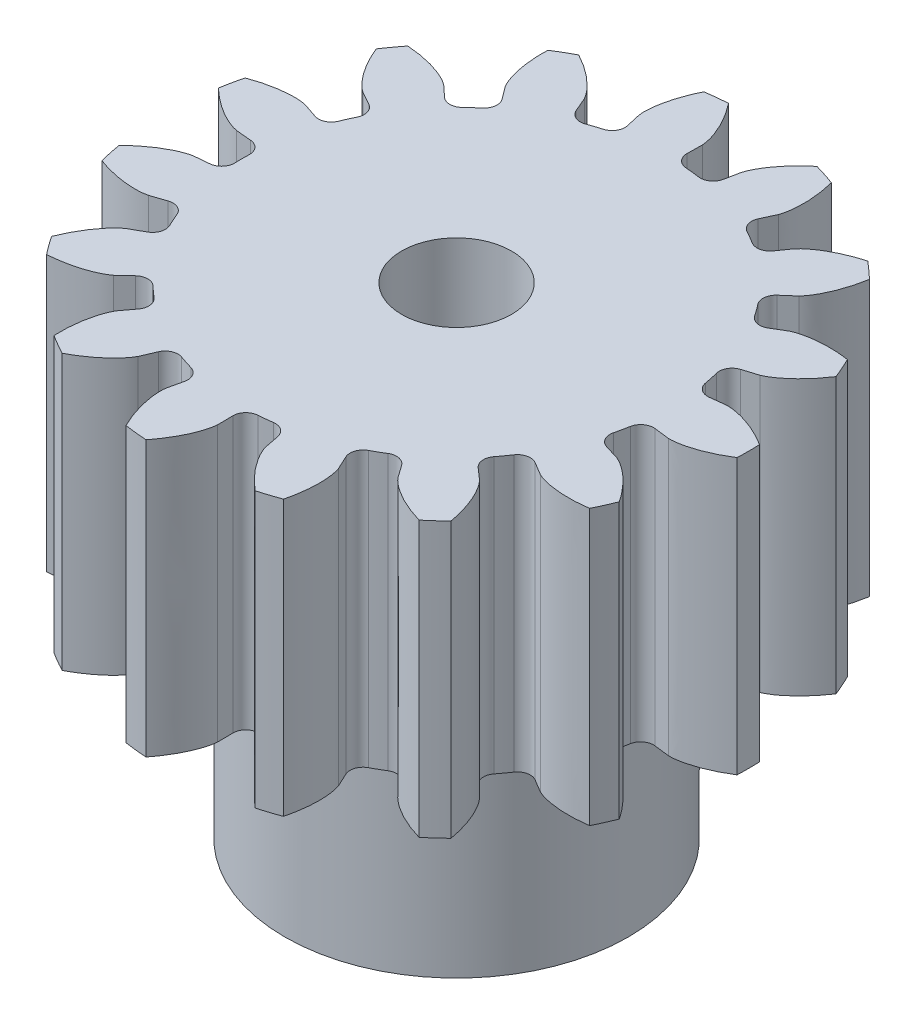
from build123d import *

# Parameters (mm, degrees)
BOSS_EXTRUDE1_DEPTH      = 4
BOSS_EXTRUDE1_DEPTH_BACK = 4
SKETCH2_R                = 5
BOSS_EXTRUDE2_DEPTH      = 6
CUT_EXTRUDE1_REACH       = 20.444
SKETCH3_R                = 1.6


with BuildPart() as part:
    # Sketch1 → Boss-Extrude1 (new, two sides: drawn at the far end of the back side and taken through both)
    with BuildSketch(Plane(origin=(0, 0, 8), x_dir=(1, 0, 0), z_dir=(0, -1, 0)).offset(-BOSS_EXTRUDE1_DEPTH_BACK)):
        with BuildLine():
            Line((6.567109026, -8.789353559), (7.013376588, -8.842263002))
            add(Edge.make_bspline(
                [(7.013376588, -8.842263002), (7.13650623, -8.846158953), (7.26014648, -8.826739675), (7.380662944, -8.801207947), (7.5493573, -8.765469607), (7.714728417, -8.712040157), (7.874555163, -8.647306658), (8.089914841, -8.560081048), (8.297207677, -8.451055972), (8.493631405, -8.3269358)],
                knots=[0, 0, 0, 0, 0.000369574, 0.000369574, 0.000369574, 0.000886684, 0.000886684, 0.000886684, 0.001584079, 0.001584079, 0.001584079, 0.001584079], degree=3))
            ThreePointArc((8.493631405, -8.3269358), (8.499921204, -8), (8.493631405, -7.6730642))
            add(Edge.make_bspline(
                [(8.493631405, -7.6730642), (8.306513905, -7.554824634), (8.109584884, -7.450333654), (7.905230151, -7.36528839), (7.765919668, -7.307312258), (7.622450842, -7.257991784), (7.476161462, -7.221004491), (7.40107364, -7.20201955), (7.325048593, -7.186231596), (7.248436403, -7.174865806), (7.170725894, -7.163337076), (7.091898317, -7.155252488), (7.013376588, -7.157736998)],
                knots=[0, 0, 0, 0, 0.000664035, 0.000664035, 0.000664035, 0.001116085, 0.001116085, 0.001116085, 0.001347695, 0.001347695, 0.001347695, 0.001582954, 0.001582954, 0.001582954, 0.001582954], degree=3))
            Line((7.013376588, -7.157736998), (6.567109026, -7.210646441))
            ThreePointArc((6.567109026, -7.210646441), (6.299401561, -7.139849418), (6.153266145, -6.90463899))
            ThreePointArc((6.153266145, -6.90463899), (6.113422505, -6.700551932), (6.066811797, -6.49790326))
            ThreePointArc((6.066811797, -6.49790326), (6.104644442, -6.223589213), (6.320411637, -6.050026478))
            Line((6.320411637, -6.050026478), (6.749617551, -5.91684829))
            add(Edge.make_bspline(
                [(6.749617551, -5.91684829), (6.863686702, -5.870326081), (6.968739159, -5.802296667), (7.068451738, -5.729953811), (7.208025608, -5.628691037), (7.337367925, -5.512618312), (7.457047437, -5.388473925), (7.618310441, -5.221194693), (7.763337377, -5.037281737), (7.892295159, -4.84399959)],
                knots=[0, 0, 0, 0, 0.000369574, 0.000369574, 0.000369574, 0.000886684, 0.000886684, 0.000886684, 0.001584079, 0.001584079, 0.001584079, 0.001584079], degree=3))
            ThreePointArc((7.892295159, -4.84399959), (7.765064406, -4.542770583), (7.626341619, -4.246658159))
            add(Edge.make_bspline(
                [(7.626341619, -4.246658159), (7.407308913, -4.214748485), (7.18490499, -4.199389474), (6.963626627, -4.204815317), (6.81277915, -4.208514164), (6.661653412, -4.221811698), (6.512967325, -4.247523375), (6.436649316, -4.260720737), (6.360775441, -4.277219896), (6.286163839, -4.297997716), (6.2104826, -4.319073408), (6.135181726, -4.343749833), (6.064459099, -4.37795721)],
                knots=[0, 0, 0, 0, 0.000664035, 0.000664035, 0.000664035, 0.001116085, 0.001116085, 0.001116085, 0.001347695, 0.001347695, 0.001347695, 0.001582954, 0.001582954, 0.001582954, 0.001582954], degree=3))
            Line((6.064459099, -4.37795721), (5.678293604, -4.607805762))
            ThreePointArc((5.678293604, -4.607805762), (5.404934922, -4.652015898), (5.175764877, -4.496579109))
            ThreePointArc((5.175764877, -4.496579109), (5.056356215, -4.326342173), (4.931350574, -4.160171681))
            ThreePointArc((4.931350574, -4.160171681), (4.854338841, -3.894185407), (4.980857657, -3.647867535))
            Line((4.980857657, -3.647867535), (5.318788321, -3.351629433))
            add(Edge.make_bspline(
                [(5.318788321, -3.351629433), (5.404073389, -3.262733177), (5.472373528, -3.157856531), (5.534041011, -3.051211284), (5.620360805, -2.90193333), (5.691309861, -2.743287359), (5.750148465, -2.581197774), (5.829430956, -2.362789019), (5.887115516, -2.135788405), (5.926309381, -1.906764522)],
                knots=[0, 0, 0, 0, 0.000369574, 0.000369574, 0.000369574, 0.000886684, 0.000886684, 0.000886684, 0.001584079, 0.001584079, 0.001584079, 0.001584079], degree=3))
            ThreePointArc((5.926309381, -1.906764522), (5.687557429, -1.68332754), (5.440388084, -1.469239021))
            add(Edge.make_bspline(
                [(5.440388084, -1.469239021), (5.227312916, -1.529176712), (5.01788975, -1.605605381), (4.817948796, -1.700564154), (4.681647225, -1.765298415), (4.548995588, -1.838914692), (4.42362197, -1.922879558), (4.35926985, -1.965977279), (4.296666428, -2.011910696), (4.236956439, -2.061239451), (4.176390443, -2.111275387), (4.117636479, -2.164446048), (4.066941537, -2.224461526)],
                knots=[0, 0, 0, 0, 0.000664035, 0.000664035, 0.000664035, 0.001116085, 0.001116085, 0.001116085, 0.001347695, 0.001347695, 0.001347695, 0.001582954, 0.001582954, 0.001582954, 0.001582954], degree=3))
            Line((4.066941537, -2.224461526), (3.807649632, -2.591506283))
            ThreePointArc((3.807649632, -2.591506283), (3.575905932, -2.743079246), (3.30332684, -2.694292527))
            ThreePointArc((3.30332684, -2.694292527), (3.125, -2.587341226), (2.943214036, -2.486381303))
            ThreePointArc((2.943214036, -2.486381303), (2.764673953, -2.274714244), (2.780068139, -1.998231832))
            Line((2.780068139, -1.998231832), (2.96829227, -1.590156076))
            add(Edge.make_bspline(
                [(2.96829227, -1.590156076), (3.010046692, -1.474256743), (3.029784799, -1.35066699), (3.042744319, -1.228159284), (3.06088456, -1.056677664), (3.061172619, -0.882889777), (3.048996584, -0.710881757), (3.0325899, -0.479108337), (2.992957899, -0.248270532), (2.935610871, -0.023105224)],
                knots=[0, 0, 0, 0, 0.000369574, 0.000369574, 0.000369574, 0.000886684, 0.000886684, 0.000886684, 0.001584079, 0.001584079, 0.001584079, 0.001584079], degree=3))
            ThreePointArc((2.935610871, -0.023105224), (2.626620103, 0.083905449), (2.313742025, 0.178952213))
            add(Edge.make_bspline(
                [(2.313742025, 0.178952213), (2.143467028, 0.03753093), (1.983235787, -0.117470209), (1.839203848, -0.285542678), (1.741015964, -0.400119211), (1.6497751, -0.521325308), (1.569392189, -0.649025074), (1.528133024, -0.714571167), (1.489624757, -0.781996537), (1.455140779, -0.851346838), (1.420162438, -0.92169135), (1.388114476, -0.994162555), (1.366212837, -1.069608913)],
                knots=[0, 0, 0, 0, 0.000664035, 0.000664035, 0.000664035, 0.001116085, 0.001116085, 0.001116085, 0.001347695, 0.001347695, 0.001347695, 0.001582954, 0.001582954, 0.001582954, 0.001582954], degree=3))
            Line((1.366212837, -1.069608913), (1.278628447, -1.510384503))
            ThreePointArc((1.278628447, -1.510384503), (1.128570321, -1.743111949), (0.859713583, -1.809410969))
            ThreePointArc((0.859713583, -1.809410969), (0.653302895, -1.784238154), (0.446169054, -1.765945687))
            ThreePointArc((0.446169054, -1.765945687), (0.196971823, -1.645197001), (0.098579583, -1.38635637))
            Line((0.098579583, -1.38635637), (0.10455152, -0.937002965))
            add(Edge.make_bspline(
                [(0.10455152, -0.937002965), (0.095555577, -0.814140602), (0.063318754, -0.693207534), (0.025329491, -0.576020064), (-0.027846432, -0.411985508), (-0.09826918, -0.253105209), (-0.179354506, -0.100920504), (-0.2886135, 0.104141852), (-0.418709328, 0.298902893), (-0.562681427, 0.4812765)],
                knots=[0, 0, 0, 0, 0.000369574, 0.000369574, 0.000369574, 0.000886684, 0.000886684, 0.000886684, 0.001584079, 0.001584079, 0.001584079, 0.001584079], degree=3))
            ThreePointArc((-0.562681427, 0.4812765), (-0.888483701, 0.453357746), (-1.21297105, 0.412928307))
            add(Edge.make_bspline(
                [(-1.21297105, 0.412928307), (-1.311003782, 0.214476455), (-1.394337662, 0.007703951), (-1.457556153, -0.204420956), (-1.500652775, -0.349028438), (-1.53470649, -0.49686672), (-1.556199759, -0.646220937), (-1.567231884, -0.722881886), (-1.574986569, -0.80014075), (-1.57828194, -0.8775213), (-1.581624555, -0.956011182), (-1.58142513, -1.035252003), (-1.570746474, -1.11308388)],
                knots=[0, 0, 0, 0, 0.000664035, 0.000664035, 0.000664035, 0.001116085, 0.001116085, 0.001116085, 0.001347695, 0.001347695, 0.001347695, 0.001582954, 0.001582954, 0.001582954, 0.001582954], degree=3))
            Line((-1.570746474, -1.11308388), (-1.471479212, -1.551376199))
            ThreePointArc((-1.471479212, -1.551376199), (-1.513905352, -1.825017438), (-1.732551962, -1.994938493))
            ThreePointArc((-1.732551962, -1.994938493), (-1.931356215, -2.055896773), (-2.128022611, -2.123434697))
            ThreePointArc((-2.128022611, -2.123434697), (-2.404788525, -2.114482928), (-2.599954278, -1.918039975))
            Line((-2.599954278, -1.918039975), (-2.777267138, -1.505106207))
            add(Edge.make_bspline(
                [(-2.777267138, -1.505106207), (-2.835457966, -1.396524834), (-2.914095679, -1.299158875), (-2.996465036, -1.20755442), (-3.111762524, -1.079329993), (-3.240719344, -0.962829129), (-3.376693572, -0.856781856), (-3.559913004, -0.713887709), (-3.757977909, -0.588879385), (-3.963680994, -0.480831533)],
                knots=[0, 0, 0, 0, 0.000369574, 0.000369574, 0.000369574, 0.000886684, 0.000886684, 0.000886684, 0.001584079, 0.001584079, 0.001584079, 0.001584079], degree=3))
            ThreePointArc((-3.963680994, -0.480831533), (-4.249960602, -0.638852307), (-4.529950411, -0.807767333))
            add(Edge.make_bspline(
                [(-4.529950411, -0.807767333), (-4.538790128, -1.028935625), (-4.530817461, -1.251726649), (-4.502291454, -1.471225671), (-4.482845015, -1.620860155), (-4.453823386, -1.76976804), (-4.412710631, -1.914952006), (-4.391608162, -1.989472438), (-4.367268408, -2.063206036), (-4.338805374, -2.135237034), (-4.309934294, -2.208300674), (-4.277521964, -2.280609652), (-4.236109451, -2.347369209)],
                knots=[0, 0, 0, 0, 0.000664035, 0.000664035, 0.000664035, 0.001116085, 0.001116085, 0.001116085, 0.001347695, 0.001347695, 0.001347695, 0.001582954, 0.001582954, 0.001582954, 0.001582954], degree=3))
            Line((-4.236109451, -2.347369209), (-3.967154748, -2.707393534))
            ThreePointArc((-3.967154748, -2.707393534), (-3.894613036, -2.974633511), (-4.025243534, -3.218795707))
            ThreePointArc((-4.025243534, -3.218795707), (-4.18206629, -3.355344841), (-4.334259835, -3.497035234))
            ThreePointArc((-4.334259835, -3.497035234), (-4.59073909, -3.601428225), (-4.848932425, -3.501349721))
            Line((-4.848932425, -3.501349721), (-5.178871077, -3.19623559))
            add(Edge.make_bspline(
                [(-5.178871077, -3.19623559), (-5.276195067, -3.120709912), (-5.387636496, -3.063746522), (-5.500143536, -3.013564324), (-5.657626606, -2.943321194), (-5.822819693, -2.889343824), (-5.990171643, -2.84777052), (-6.215671209, -2.791752278), (-6.447457969, -2.758111746), (-6.679324109, -2.743072103)],
                knots=[0, 0, 0, 0, 0.000369574, 0.000369574, 0.000369574, 0.000886684, 0.000886684, 0.000886684, 0.001584079, 0.001584079, 0.001584079, 0.001584079], degree=3))
            ThreePointArc((-6.679324109, -2.743072103), (-6.876580705, -3.003871671), (-7.063660193, -3.27206534))
            add(Edge.make_bspline(
                [(-7.063660193, -3.27206534), (-6.981778428, -3.477708065), (-6.883877761, -3.677995018), (-6.768539661, -3.86691478), (-6.689912627, -3.995703104), (-6.602833756, -4.119933065), (-6.506223747, -4.235843155), (-6.456635492, -4.295337809), (-6.404409863, -4.352796933), (-6.349109942, -4.407023566), (-6.293017238, -4.462027595), (-6.233996391, -4.514901852), (-6.169010619, -4.559045755)],
                knots=[0, 0, 0, 0, 0.000664035, 0.000664035, 0.000664035, 0.001116085, 0.001116085, 0.001116085, 0.001347695, 0.001347695, 0.001347695, 0.001582954, 0.001582954, 0.001582954, 0.001582954], degree=3))
            Line((-6.169010619, -4.559045755), (-5.776873187, -4.778550608))
            ThreePointArc((-5.776873187, -4.778550608), (-5.601906744, -4.993181103), (-5.62193393, -5.269366579))
            ThreePointArc((-5.62193393, -5.269366579), (-5.70965911, -5.457895981), (-5.791064157, -5.649239287))
            ThreePointArc((-5.791064157, -5.649239287), (-5.982909161, -5.848926542), (-6.259486104, -5.862516969))
            Line((-6.259486104, -5.862516969), (-6.685001158, -5.71797948))
            add(Edge.make_bspline(
                [(-6.685001158, -5.71797948), (-6.804630108, -5.688568573), (-6.929606017, -5.68185724), (-7.052797252, -5.681774257), (-7.225235649, -5.681658099), (-7.398101619, -5.6995374), (-7.567894618, -5.729626467), (-7.796683394, -5.770170193), (-8.022113973, -5.833714206), (-8.240051405, -5.914283265)],
                knots=[0, 0, 0, 0, 0.000369574, 0.000369574, 0.000369574, 0.000886684, 0.000886684, 0.000886684, 0.001584079, 0.001584079, 0.001584079, 0.001584079], degree=3))
            ThreePointArc((-8.240051405, -5.914283265), (-8.314177532, -6.232767011), (-8.375998955, -6.553866202))
            add(Edge.make_bspline(
                [(-8.375998955, -6.553866202), (-8.217553809, -6.708425865), (-8.046653057, -6.851577312), (-7.86444587, -6.977251872), (-7.74023357, -7.062925364), (-7.610154186, -7.140996913), (-7.47475167, -7.207591218), (-7.405251888, -7.241772929), (-7.334170672, -7.273022374), (-7.261595722, -7.300068364), (-7.187980332, -7.327502086), (-7.112556207, -7.351799182), (-7.035233808, -7.36569455)],
                knots=[0, 0, 0, 0, 0.000664035, 0.000664035, 0.000664035, 0.001116085, 0.001116085, 0.001116085, 0.001347695, 0.001347695, 0.001347695, 0.001582954, 0.001582954, 0.001582954, 0.001582954], degree=3))
            Line((-7.035233808, -7.36569455), (-6.587717771, -7.406725549))
            ThreePointArc((-6.587717771, -7.406725549), (-6.340579885, -7.531634999), (-6.246540877, -7.792088776))
            ThreePointArc((-6.246540877, -7.792088776), (-6.25, -8), (-6.246540877, -8.207911224))
            ThreePointArc((-6.246540877, -8.207911224), (-6.340579885, -8.468365001), (-6.587717771, -8.593274451))
            Line((-6.587717771, -8.593274451), (-7.035233808, -8.63430545))
            add(Edge.make_bspline(
                [(-7.035233808, -8.63430545), (-7.156482786, -8.656094727), (-7.273383704, -8.700795901), (-7.38595825, -8.750826481), (-7.54353581, -8.820857381), (-7.694184564, -8.907501859), (-7.837059861, -9.004050624), (-8.029578189, -9.134145939), (-8.209673592, -9.283887161), (-8.375998955, -9.446133798)],
                knots=[0, 0, 0, 0, 0.000369574, 0.000369574, 0.000369574, 0.000886684, 0.000886684, 0.000886684, 0.001584079, 0.001584079, 0.001584079, 0.001584079], degree=3))
            ThreePointArc((-8.375998955, -9.446133798), (-8.314177532, -9.767232989), (-8.240051405, -10.085716735))
            add(Edge.make_bspline(
                [(-8.240051405, -10.085716735), (-8.032439483, -10.162468567), (-7.818088938, -10.223732323), (-7.600517942, -10.264431406), (-7.452197811, -10.292176342), (-7.30160982, -10.310590199), (-7.150827123, -10.316353959), (-7.073432959, -10.319312397), (-6.995786742, -10.31894885), (-6.918485631, -10.3141377), (-6.840076326, -10.309257577), (-6.76129044, -10.300776323), (-6.685001158, -10.28202052)],
                knots=[0, 0, 0, 0, 0.000664035, 0.000664035, 0.000664035, 0.001116085, 0.001116085, 0.001116085, 0.001347695, 0.001347695, 0.001347695, 0.001582954, 0.001582954, 0.001582954, 0.001582954], degree=3))
            Line((-6.685001158, -10.28202052), (-6.259486104, -10.137483031))
            ThreePointArc((-6.259486104, -10.137483031), (-5.982909161, -10.151073458), (-5.791064157, -10.350760713))
            ThreePointArc((-5.791064157, -10.350760713), (-5.70965911, -10.542104019), (-5.62193393, -10.730633421))
            ThreePointArc((-5.62193393, -10.730633421), (-5.601906744, -11.006818897), (-5.776873187, -11.221449392))
            Line((-5.776873187, -11.221449392), (-6.169010619, -11.440954245))
            add(Edge.make_bspline(
                [(-6.169010619, -11.440954245), (-6.270914575, -11.510176142), (-6.359527273, -11.598560583), (-6.442019967, -11.690053985), (-6.557490098, -11.818122964), (-6.659873099, -11.958551002), (-6.751126257, -12.104865306), (-6.87408597, -12.302017549), (-6.977706065, -12.512064361), (-7.063660193, -12.72793466)],
                knots=[0, 0, 0, 0, 0.000369574, 0.000369574, 0.000369574, 0.000886684, 0.000886684, 0.000886684, 0.001584079, 0.001584079, 0.001584079, 0.001584079], degree=3))
            ThreePointArc((-7.063660193, -12.72793466), (-6.876580705, -12.996128329), (-6.679324109, -13.256927897))
            add(Edge.make_bspline(
                [(-6.679324109, -13.256927897), (-6.458443398, -13.242600808), (-6.237706217, -13.211383812), (-6.022391413, -13.160070178), (-5.875609349, -13.125089206), (-5.730550784, -13.080661448), (-5.590459603, -13.024598056), (-5.518553211, -12.995821682), (-5.44776773, -12.963908004), (-5.379106522, -12.928071605), (-5.309460983, -12.891721453), (-5.240936131, -12.851928335), (-5.178871077, -12.80376441)],
                knots=[0, 0, 0, 0, 0.000664035, 0.000664035, 0.000664035, 0.001116085, 0.001116085, 0.001116085, 0.001347695, 0.001347695, 0.001347695, 0.001582954, 0.001582954, 0.001582954, 0.001582954], degree=3))
            Line((-5.178871077, -12.80376441), (-4.848932425, -12.498650279))
            ThreePointArc((-4.848932425, -12.498650279), (-4.59073909, -12.398571775), (-4.334259835, -12.502964766))
            ThreePointArc((-4.334259835, -12.502964766), (-4.18206629, -12.644655159), (-4.025243534, -12.781204293))
            ThreePointArc((-4.025243534, -12.781204293), (-3.894613036, -13.025366489), (-3.967154748, -13.292606466))
            Line((-3.967154748, -13.292606466), (-4.236109451, -13.652630791))
            add(Edge.make_bspline(
                [(-4.236109451, -13.652630791), (-4.301048265, -13.757316213), (-4.346050801, -13.87410145), (-4.384197908, -13.991237633), (-4.437594776, -14.1552004), (-4.474009073, -14.325130714), (-4.497861591, -14.495911486), (-4.530001837, -14.726031242), (-4.539229769, -14.960064643), (-4.529950411, -15.192232667)],
                knots=[0, 0, 0, 0, 0.000369574, 0.000369574, 0.000369574, 0.000886684, 0.000886684, 0.000886684, 0.001584079, 0.001584079, 0.001584079, 0.001584079], degree=3))
            ThreePointArc((-4.529950411, -15.192232667), (-4.249960602, -15.361147693), (-3.963680994, -15.519168467))
            add(Edge.make_bspline(
                [(-3.963680994, -15.519168467), (-3.767723776, -15.416239741), (-3.578767423, -15.297939697), (-3.402938697, -15.163485939), (-3.283074653, -15.071827587), (-3.168627456, -14.972240176), (-3.06345083, -14.864043503), (-3.009465478, -14.808508013), (-2.957780186, -14.750562368), (-2.909631028, -14.689897159), (-2.860791601, -14.62836225), (-2.814376353, -14.56413786), (-2.777267138, -14.494893793)],
                knots=[0, 0, 0, 0, 0.000664035, 0.000664035, 0.000664035, 0.001116085, 0.001116085, 0.001116085, 0.001347695, 0.001347695, 0.001347695, 0.001582954, 0.001582954, 0.001582954, 0.001582954], degree=3))
            Line((-2.777267138, -14.494893793), (-2.599954278, -14.081960025))
            ThreePointArc((-2.599954278, -14.081960025), (-2.404788525, -13.885517072), (-2.128022611, -13.876565303))
            ThreePointArc((-2.128022611, -13.876565303), (-1.931356215, -13.944103227), (-1.732551962, -14.005061507))
            ThreePointArc((-1.732551962, -14.005061507), (-1.513905352, -14.174982562), (-1.471479212, -14.448623801))
            Line((-1.471479212, -14.448623801), (-1.570746474, -14.88691612))
            add(Edge.make_bspline(
                [(-1.570746474, -14.88691612), (-1.587491636, -15.008964007), (-1.581102663, -15.13395681), (-1.568308202, -15.256481865), (-1.550399002, -15.427987769), (-1.514548232, -15.598037864), (-1.466875795, -15.763755556), (-1.402639232, -15.98705303), (-1.315879408, -16.204606518), (-1.21297105, -16.412928307)],
                knots=[0, 0, 0, 0, 0.000369574, 0.000369574, 0.000369574, 0.000886684, 0.000886684, 0.000886684, 0.001584079, 0.001584079, 0.001584079, 0.001584079], degree=3))
            ThreePointArc((-1.21297105, -16.412928307), (-0.888483701, -16.453357746), (-0.562681427, -16.4812765))
            add(Edge.make_bspline(
                [(-0.562681427, -16.4812765), (-0.425530485, -16.307543449), (-0.30102723, -16.122615508), (-0.195086966, -15.928269903), (-0.122866523, -15.795782733), (-0.058819656, -15.658255237), (-0.006743578, -15.51663347), (0.019986176, -15.443941454), (0.043634423, -15.369983172), (0.062946104, -15.294978719), (0.082534638, -15.218898997), (0.098814664, -15.141348316), (0.10455152, -15.062997035)],
                knots=[0, 0, 0, 0, 0.000664035, 0.000664035, 0.000664035, 0.001116085, 0.001116085, 0.001116085, 0.001347695, 0.001347695, 0.001347695, 0.001582954, 0.001582954, 0.001582954, 0.001582954], degree=3))
            Line((0.10455152, -15.062997035), (0.098579583, -14.61364363))
            ThreePointArc((0.098579583, -14.61364363), (0.196971823, -14.354802999), (0.446169054, -14.234054313))
            ThreePointArc((0.446169054, -14.234054313), (0.653302895, -14.215761846), (0.859713583, -14.190589031))
            ThreePointArc((0.859713583, -14.190589031), (1.128570321, -14.256888051), (1.278628447, -14.489615497))
            Line((1.278628447, -14.489615497), (1.366212837, -14.930391087))
            add(Edge.make_bspline(
                [(1.366212837, -14.930391087), (1.400556719, -15.048698251), (1.457232489, -15.160286229), (1.51875624, -15.267014459), (1.604874844, -15.416408571), (1.706791757, -15.557175242), (1.817746153, -15.689175759), (1.967252438, -15.867040788), (2.134998457, -16.030497389), (2.313742025, -16.178952213)],
                knots=[0, 0, 0, 0, 0.000369574, 0.000369574, 0.000369574, 0.000886684, 0.000886684, 0.000886684, 0.001584079, 0.001584079, 0.001584079, 0.001584079], degree=3))
            ThreePointArc((2.313742025, -16.178952213), (2.626620103, -16.083905449), (2.935610871, -15.976894776))
            add(Edge.make_bspline(
                [(2.935610871, -15.976894776), (2.990240893, -15.762397423), (3.028763307, -15.542817307), (3.046497074, -15.322183974), (3.058586345, -15.171776221), (3.061158598, -15.020088395), (3.051129699, -14.869529224), (3.045982039, -14.792249792), (3.037504244, -14.715066931), (3.024639283, -14.638692185), (3.011589889, -14.561222526), (2.994919729, -14.48375477), (2.96829227, -14.409843924)],
                knots=[0, 0, 0, 0, 0.000664035, 0.000664035, 0.000664035, 0.001116085, 0.001116085, 0.001116085, 0.001347695, 0.001347695, 0.001347695, 0.001582954, 0.001582954, 0.001582954, 0.001582954], degree=3))
            Line((2.96829227, -14.409843924), (2.780068139, -14.001768168))
            ThreePointArc((2.780068139, -14.001768168), (2.764673953, -13.725285756), (2.943214036, -13.513618697))
            ThreePointArc((2.943214036, -13.513618697), (3.125, -13.412658774), (3.30332684, -13.305707473))
            ThreePointArc((3.30332684, -13.305707473), (3.575905932, -13.256920754), (3.807649632, -13.408493717))
            Line((3.807649632, -13.408493717), (4.066941537, -13.775538474))
            add(Edge.make_bspline(
                [(4.066941537, -13.775538474), (4.146436093, -13.869648531), (4.243598905, -13.948537109), (4.343213931, -14.021014235), (4.48265125, -14.122464955), (4.633011946, -14.209608365), (4.788063278, -14.285067619), (4.99698829, -14.386745724), (5.216715693, -14.467842307), (5.440388084, -14.530760979)],
                knots=[0, 0, 0, 0, 0.000369574, 0.000369574, 0.000369574, 0.000886684, 0.000886684, 0.000886684, 0.001584079, 0.001584079, 0.001584079, 0.001584079], degree=3))
            ThreePointArc((5.440388084, -14.530760979), (5.687557429, -14.31667246), (5.926309381, -14.093235478))
            add(Edge.make_bspline(
                [(5.926309381, -14.093235478), (5.888972455, -13.875062364), (5.834853152, -13.658797468), (5.761314093, -13.450025917), (5.711181847, -13.307704447), (5.65183472, -13.168084493), (5.581434934, -13.034620967), (5.545299935, -12.966116436), (5.506161986, -12.899054613), (5.463344851, -12.834515462), (5.419913888, -12.769051074), (5.373175964, -12.705061122), (5.318788321, -12.648370567)],
                knots=[0, 0, 0, 0, 0.000664035, 0.000664035, 0.000664035, 0.001116085, 0.001116085, 0.001116085, 0.001347695, 0.001347695, 0.001347695, 0.001582954, 0.001582954, 0.001582954, 0.001582954], degree=3))
            Line((5.318788321, -12.648370567), (4.980857657, -12.352132465))
            ThreePointArc((4.980857657, -12.352132465), (4.854338841, -12.105814593), (4.931350574, -11.839828319))
            ThreePointArc((4.931350574, -11.839828319), (5.056356215, -11.673657827), (5.175764877, -11.503420891))
            ThreePointArc((5.175764877, -11.503420891), (5.404934922, -11.347984102), (5.678293604, -11.392194238))
            Line((5.678293604, -11.392194238), (6.064459099, -11.62204279))
            add(Edge.make_bspline(
                [(6.064459099, -11.62204279), (6.175358998, -11.675683256), (6.296208519, -11.708231882), (6.416690476, -11.73392595), (6.585336531, -11.769891528), (6.758142279, -11.788343789), (6.930480763, -11.79421419), (7.16269947, -11.802124303), (7.396415393, -11.786838532), (7.626341619, -11.753341841)],
                knots=[0, 0, 0, 0, 0.000369574, 0.000369574, 0.000369574, 0.000886684, 0.000886684, 0.000886684, 0.001584079, 0.001584079, 0.001584079, 0.001584079], degree=3))
            ThreePointArc((7.626341619, -11.753341841), (7.765064406, -11.457229417), (7.892295159, -11.15600041))
            add(Edge.make_bspline(
                [(7.892295159, -11.15600041), (7.76944718, -10.971875648), (7.632043879, -10.796320139), (7.479947566, -10.635508866), (7.376262124, -10.525882356), (7.265257274, -10.422471832), (7.146659362, -10.329181007), (7.085785095, -10.281296432), (7.022754299, -10.235951246), (6.957388463, -10.194407095), (6.891085538, -10.152267365), (6.822361261, -10.112819662), (6.749617551, -10.08315171)],
                knots=[0, 0, 0, 0, 0.000664035, 0.000664035, 0.000664035, 0.001116085, 0.001116085, 0.001116085, 0.001347695, 0.001347695, 0.001347695, 0.001582954, 0.001582954, 0.001582954, 0.001582954], degree=3))
            Line((6.749617551, -10.08315171), (6.320411637, -9.949973522))
            ThreePointArc((6.320411637, -9.949973522), (6.104644442, -9.776410787), (6.066811797, -9.50209674))
            ThreePointArc((6.066811797, -9.50209674), (6.113422505, -9.299448068), (6.153266145, -9.09536101))
            ThreePointArc((6.153266145, -9.09536101), (6.299401561, -8.860150582), (6.567109026, -8.789353559))
        make_face()
    extrude(amount=BOSS_EXTRUDE1_DEPTH + BOSS_EXTRUDE1_DEPTH_BACK)

    # Sketch2 → Boss-Extrude2 (add)
    with BuildSketch(Plane(origin=(0, -4, 0), x_dir=(-1, 0, 0), z_dir=(0, -1, 0))):
        Circle(SKETCH2_R)
    extrude(amount=BOSS_EXTRUDE2_DEPTH)

    # Sketch3 → Cut-Extrude1 (cut, up to next)
    with BuildSketch(Plane(origin=(0, -10, 0), x_dir=(-1, 0, 0), z_dir=(0, -1, 0)), mode=Mode.PRIVATE) as cut_extrude1_sk1:
        Circle(SKETCH3_R)
    cut_extrude1_tool1 = extrude(cut_extrude1_sk1.sketch, amount=-CUT_EXTRUDE1_REACH, mode=Mode.PRIVATE) & part.part
    add(cut_extrude1_tool1.solids().sort_by_distance((0, -10, 0))[0], mode=Mode.SUBTRACT)


solid = part.part
